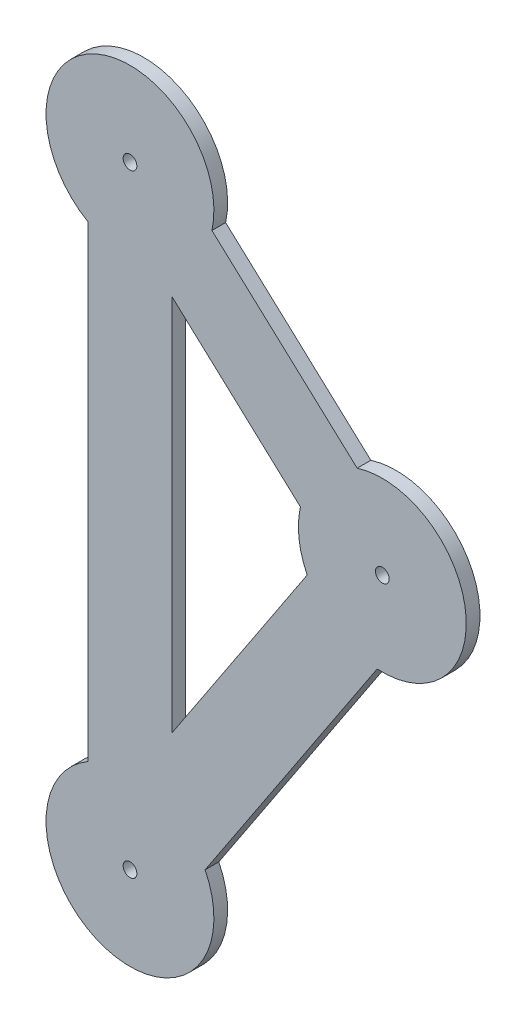
from build123d import *

# Parameters (mm, degrees)
SKETCH1_R           = 3.1115
BOSS_EXTRUDE1_DEPTH = 6.223


with BuildPart() as part:
    # Sketch1 → Boss-Extrude1 (new body)
    with BuildSketch(Plane.XY):
        with BuildLine():
            ThreePointArc((56.241862877, 269.861061996), (3.715941389, 313.008025267), (0, 245.134432116))
            Line((0, 245.134432116), (0, 32.995567884))
            ThreePointArc((0, 32.995567884), (8.068918145, -36.483226849), (53.14774846, 16.998633767))
            Line((53.14774846, 16.998633767), (131.266861023, 135.012436144))
            ThreePointArc((131.266861023, 135.012436144), (171.412005233, 177.672174614), (122.159665516, 209.384836474))
            Line((122.159665516, 209.384836474), (56.241862877, 269.861061996))
        make_face()
        with Locations((19.05, 0)):
            Circle(SKETCH1_R, mode=Mode.SUBTRACT)
        with Locations((19.05, 278.13)):
            Circle(SKETCH1_R, mode=Mode.SUBTRACT)
        with BuildLine():
            Line((99.496738121, 156.042635639), (38.1, 63.291165717))
            Line((38.1, 63.291165717), (38.1, 234.79989424))
            Line((38.1, 234.79989424), (96.402623704, 181.31020741))
            ThreePointArc((96.402623704, 181.31020741), (95.77696793, 168.410364199), (99.496738121, 156.042635639))
        make_face(mode=Mode.SUBTRACT)
        with Locations((133.594486582, 173.041269406)):
            Circle(SKETCH1_R, mode=Mode.SUBTRACT)
    extrude(amount=BOSS_EXTRUDE1_DEPTH)


solid = part.part
